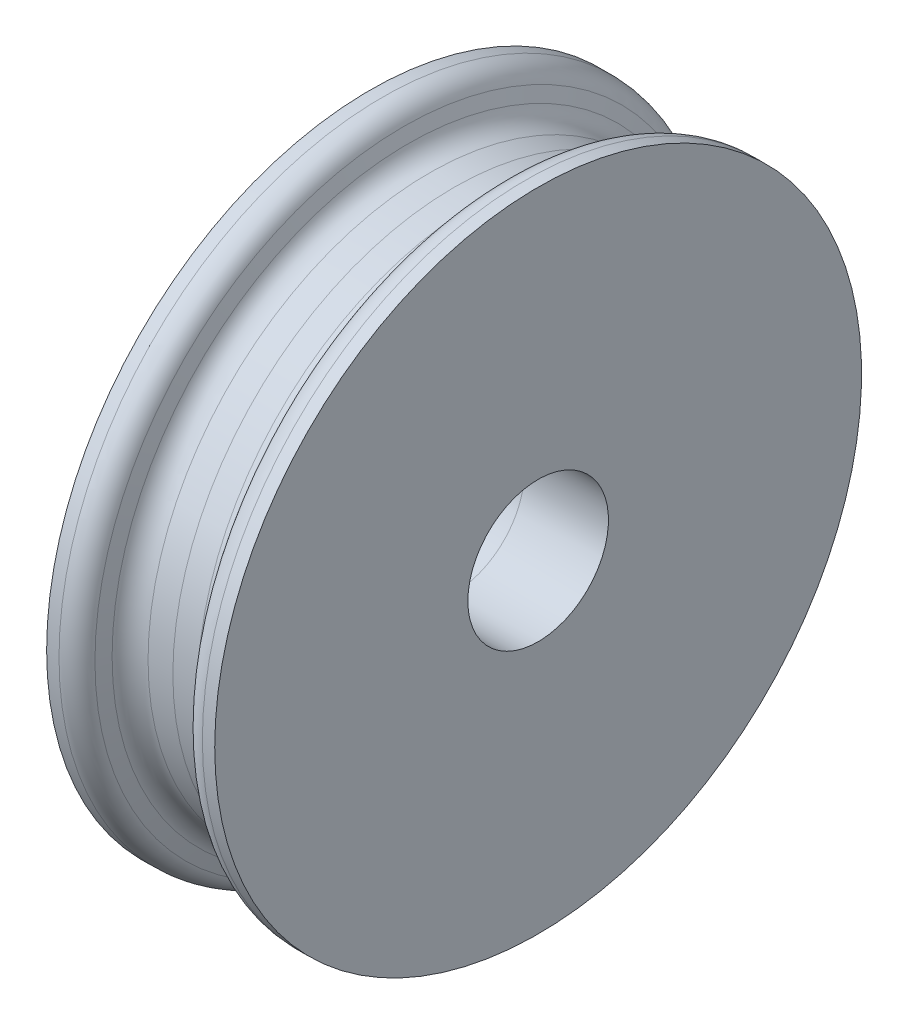
from build123d import *

# Parameters (mm, degrees)
FILLET1_R = 2.54


with BuildPart() as part:
    # Sketch2 → Revolve1 (revolve)
    with BuildSketch(Plane.XY, mode=Mode.PRIVATE) as revolve1_sk:
        Polygon((3.175, 7.9375), (22.1514, 7.9375), (22.1514, 36.5125), (18.9764, 36.5125), (17.242991759, 31.75), (8.083408241, 31.75), (6.35, 36.5125), (3.175, 36.5125), align=None)
    revolve(revolve1_sk.sketch.rotate(Axis((-22.1514, 0, 0), (1, 0, 0)), 90), axis=Axis((-22.1514, 0, 0), (1, 0, 0)))

    # Fillet1
    fillet1_edges = [part.edges().sort_by_distance(p)[0] for p in [
        (6.35, 0, -36.5125),
        (8.083408241, 0, -31.75),
        (17.242991759, 0, -31.75),
        (18.9764, 0, -36.5125),
    ]]
    fillet(fillet1_edges, radius=FILLET1_R)


with BuildPart() as body_2:
    # Split1: the piece on the far side of the plane
    add(part.part)
    split(bisect_by=Plane(origin=(12.6632, 0, 0), x_dir=(0, 0, 1), z_dir=(1, 0, 0)), keep=Keep.BOTTOM)


with BuildPart() as part_1:
    add(part.part)

    # Split1
    split(bisect_by=Plane(origin=(12.6632, 0, 0), x_dir=(0, 0, 1), z_dir=(1, 0, 0)), keep=Keep.TOP)


solid = Compound([body_2.part, part_1.part])
